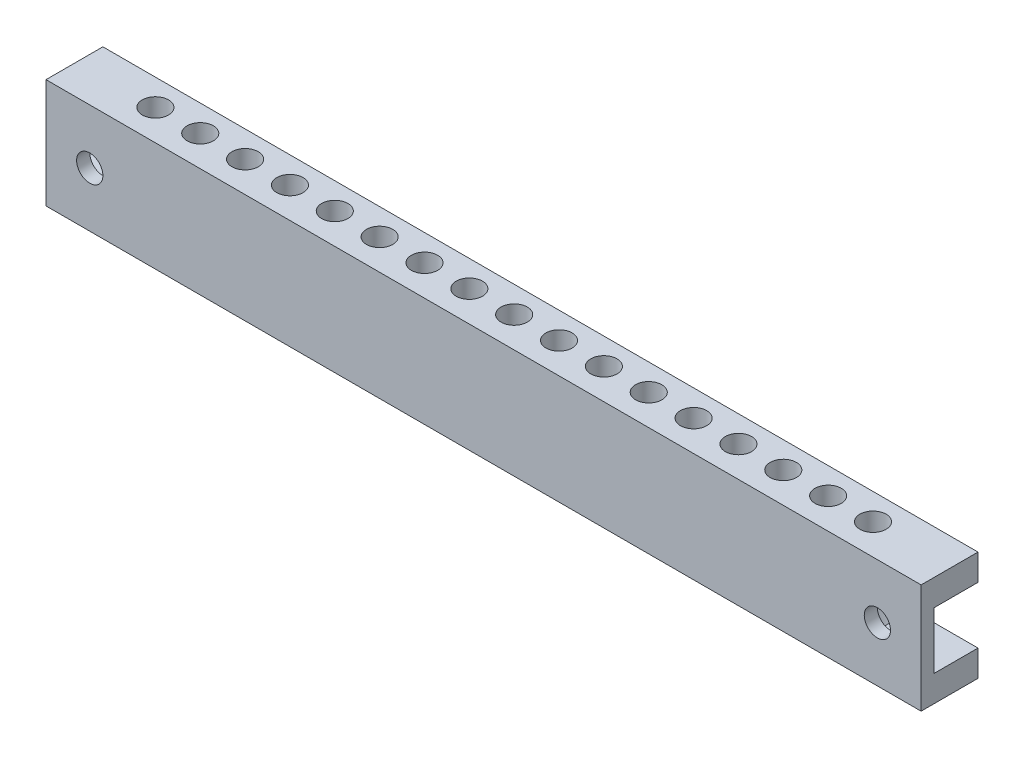
from build123d import *

# Parameters (mm, degrees)
SKETCH1_W               = 100
SKETCH1_H               = 12.5
BOSS_EXTRUDE1_DEPTH     = 1.5
SKETCH2_W               = 100
SKETCH2_H               = 3
BOSS_EXTRUDE2_DEPTH     = 5
CUT_EXTRUDE1_DEPTH      = 52.780787943
CUT_EXTRUDE1_DEPTH_BACK = 52.780787943
SKETCH3_R               = 1.5
SKETCH4_R               = 1.5
CUT_EXTRUDE2_DEPTH      = 51.636572751


with BuildPart() as part:
    # Sketch1 → Boss-Extrude1 (new body)
    with BuildSketch(Plane.XY):
        Rectangle(SKETCH1_W, SKETCH1_H)
    extrude(amount=BOSS_EXTRUDE1_DEPTH)

    # Sketch2 → Boss-Extrude2 (add)
    with BuildSketch(Plane(origin=(0, 0, 0), x_dir=(-1, 0, 0), z_dir=(0, 0, -1))):
        with Locations((0, 4.75)):
            Rectangle(SKETCH2_W, SKETCH2_H)
        with Locations((0, -4.75)):
            Rectangle(SKETCH2_W, SKETCH2_H)
    extrude(amount=BOSS_EXTRUDE2_DEPTH)

    # Sketch3 → Cut-Extrude1 (cut, two sides: drawn at the far end of the back side and taken through both)
    with BuildSketch(Plane.XZ.offset(6.25).offset(-CUT_EXTRUDE1_DEPTH_BACK)):
        with Locations((41, -2)):
            Circle(SKETCH3_R)
        with Locations((35.875, -2)):
            Circle(SKETCH3_R)
        with Locations((30.75, -2)):
            Circle(SKETCH3_R)
        with Locations((25.625, -2)):
            Circle(SKETCH3_R)
        with Locations((20.5, -2)):
            Circle(SKETCH3_R)
        with Locations((15.375, -2)):
            Circle(SKETCH3_R)
        with Locations((10.25, -2)):
            Circle(SKETCH3_R)
        with Locations((5.125, -2)):
            Circle(SKETCH3_R)
        with Locations((0, -2)):
            Circle(SKETCH3_R)
        with Locations((-5.125, -2)):
            Circle(SKETCH3_R)
        with Locations((-10.25, -2)):
            Circle(SKETCH3_R)
        with Locations((-15.375, -2)):
            Circle(SKETCH3_R)
        with Locations((-20.5, -2)):
            Circle(SKETCH3_R)
        with Locations((-25.625, -2)):
            Circle(SKETCH3_R)
        with Locations((-30.75, -2)):
            Circle(SKETCH3_R)
        with Locations((-35.875, -2)):
            Circle(SKETCH3_R)
        with Locations((-41, -2)):
            Circle(SKETCH3_R)
    extrude(amount=CUT_EXTRUDE1_DEPTH + CUT_EXTRUDE1_DEPTH_BACK, mode=Mode.SUBTRACT)

    # Sketch4 → Cut-Extrude2 (cut, through all)
    with BuildSketch(Plane(origin=(0, 0, 0), x_dir=(-1, 0, 0), z_dir=(0, 0, -1))):
        with Locations((-45, 0)):
            Circle(SKETCH4_R)
        with Locations(Location((45, 0, 0), (0, 0, 180))):
            Circle(SKETCH4_R)
    extrude(amount=-CUT_EXTRUDE2_DEPTH, mode=Mode.SUBTRACT)


solid = part.part
